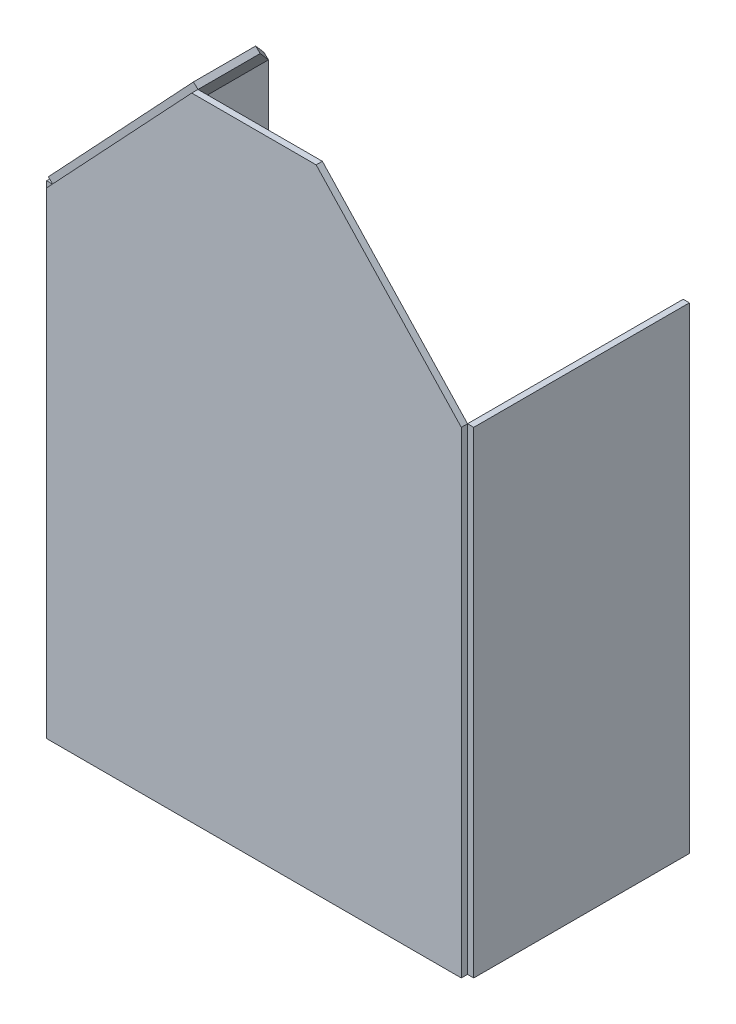
from build123d import *

# Parameters (mm, degrees)
BOSS_EXTRU_1_DEPTH = 3
BOSS_EXTRU_2_DEPTH = 3
ESQUISSE13_W       = 104
ESQUISSE13_H       = 230
BOSS_EXTRU_3_DEPTH = 3
ESQUISSE12_W       = 104
ESQUISSE12_H       = 230.086402331
BOSS_EXTRU_4_DEPTH = 3


with BuildPart() as part:
    # Esquisse1 → Boss.-Extru.1 (new body)
    with BuildSketch(Plane.XY):
        Polygon((0, 0), (200, 0), (200, 230), (130, 304.624260642), (70, 304.624260642), (0, 230), align=None)
    extrude(amount=BOSS_EXTRU_1_DEPTH)


with BuildPart() as body_2:
    # Esquisse10 → Boss.-Extru.2 (new body)
    with BuildSketch(Plane(origin=(-114.765098189, 107.653420002, 0), x_dir=(-0.6841478990944246, -0.7293433019948049, 0), z_dir=(-0.7293433019948049, 0.6841478990944246, 0))):
        Polygon((-167.748959459, 0), (-167.748959459, -104), (-270.066017061, -30), (-270.066017061, 0), align=None)
    extrude(amount=BOSS_EXTRU_2_DEPTH)


with BuildPart() as body_3:
    # Esquisse13 → Boss.-Extru.3 (new body)
    with BuildSketch(Plane(origin=(200, 0, 0), x_dir=(0, 0, -1), z_dir=(1, 0, 0))):
        with Locations((52, 115)):
            Rectangle(ESQUISSE13_W, ESQUISSE13_H)
    extrude(amount=BOSS_EXTRU_3_DEPTH)


with BuildPart() as body_4:
    # Esquisse12 → Boss.-Extru.4 (new body)
    with BuildSketch(Plane(origin=(0, 0, 0), x_dir=(0, 0, -1), z_dir=(1, 0, 0))):
        with Locations((52, 114.956798835)):
            Rectangle(ESQUISSE12_W, ESQUISSE12_H)
    extrude(amount=-BOSS_EXTRU_4_DEPTH)


solid = Compound([part.part, body_2.part, body_3.part, body_4.part])
